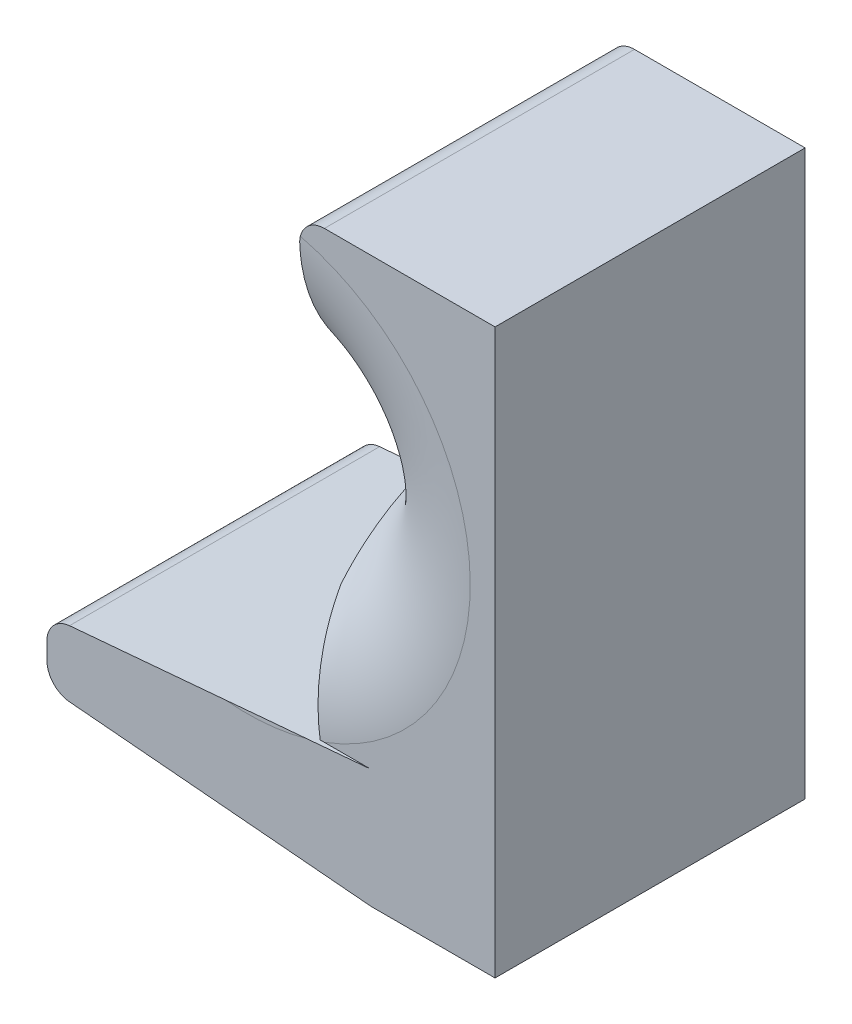
from build123d import *

# Parameters (mm, degrees)
BOSS_EXTRUDE1_DEPTH = 12.5
BOSS_EXTRUDE2_DEPTH = 5.757359
FILLET2_R           = 2


with BuildPart() as part:
    # Sketch2 → Boss-Extrude1 (new, symmetric)
    with BuildSketch(Plane.XY):
        Polygon((29.971417786, -11.489425512), (29.971417786, -34.989425512), (35.728777099, -34.989425512), (35.728777099, -47.37854209), (9.594776891, -49.66497084), (9.594776891, -54.66497084), (35.728777099, -56.951399591), (45.728777099, -56.951399591), (45.728777099, -11.489425512), align=None)
    extrude(amount=BOSS_EXTRUDE1_DEPTH, both=True)

    # Sketch4 → Boss-Extrude2 (add)
    with BuildSketch(Plane.ZY.offset(-35.728777099)):
        with BuildLine():
            Line((-12.5, -34.989425512), (-12.5, -47.37854209))
            Line((-12.5, -47.37854209), (-12.499508185, -47.37854209))
            ThreePointArc((-12.499508185, -47.37854209), (-8.79954425, -38.611474116), (-6.3e-08, -34.989425512))
            Line((-6.3e-08, -34.989425512), (-12.5, -34.989425512))
        make_face()
        with BuildLine():
            Line((12.5, -34.989425512), (-6.3e-08, -34.989425512))
            ThreePointArc((-6.3e-08, -34.989425512), (8.799544205, -38.611474071), (12.499508185, -47.37854209))
            Line((12.499508185, -47.37854209), (12.5, -47.37854209))
            Line((12.5, -47.37854209), (12.5, -34.989425512))
        make_face()
    extrude(amount=BOSS_EXTRUDE2_DEPTH)

    # Sketch3 → Cut-Revolve1 (revolve, cut)
    with BuildSketch(Plane.ZY.offset(-25.728777099)):
        with BuildLine():
            Line((-12.5, -30.489425512), (12.5, -30.489425512))
            Line((12.5, -30.489425512), (12.5, -12.489425512))
            ThreePointArc((12.5, -12.489425512), (0, -24.989425512), (-12.5, -12.489425512))
            Line((-12.5, -12.489425512), (-12.5, -30.489425512))
        make_face()
    revolve(axis=Axis((25.728777099, -30.489425512, -12.5), (0, 0, 1)), mode=Mode.SUBTRACT)

    # Fillet2
    fillet2_edges = [part.edges().sort_by_distance(p)[0] for p in [
        (29.971417786, -11.489425512, 0),
        (9.594776891, -49.66497084, 0),
        (9.594776891, -54.66497084, 0),
    ]]
    fillet(fillet2_edges, radius=FILLET2_R)


solid = part.part
